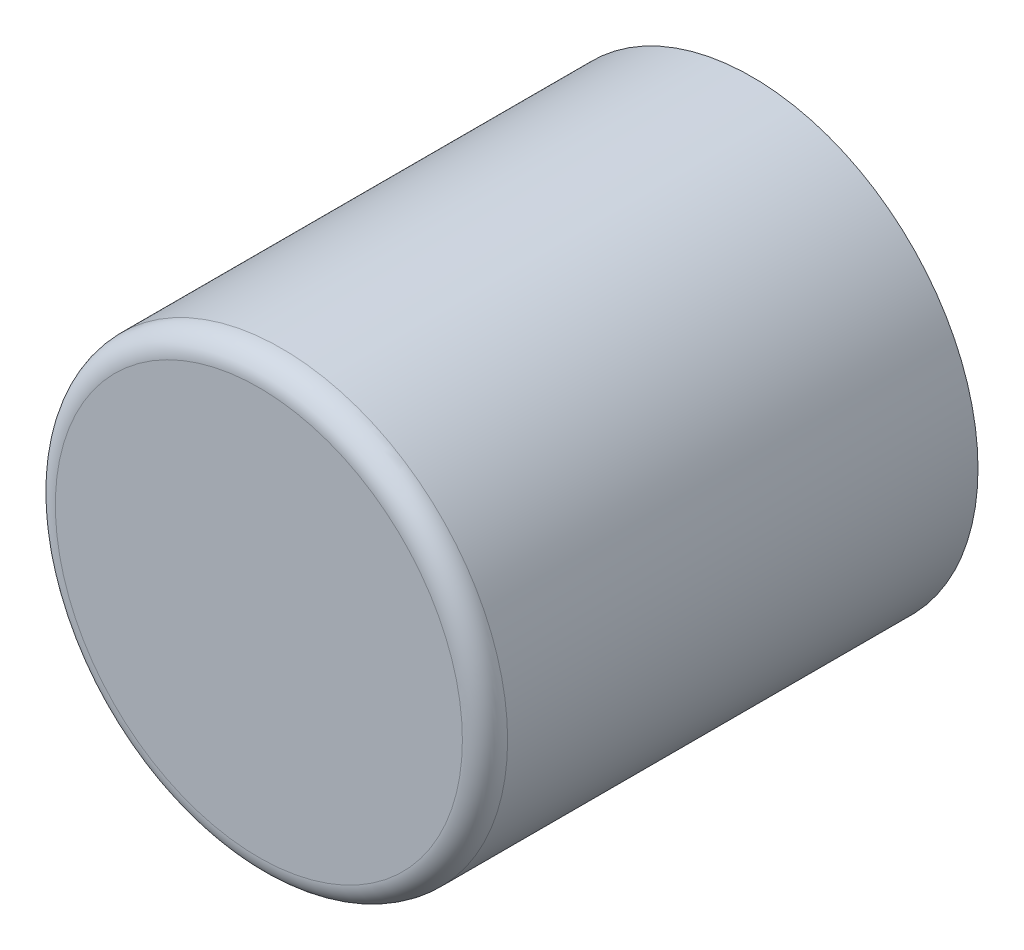
from build123d import *

# Parameters (mm, degrees)
BOSS_EXTRUDE1_DEPTH      = 150
BOSS_EXTRUDE1_DEPTH_BACK = 68
SKETCH2_R                = 100
CUT_EXTRUDE1_DEPTH       = 20
CUT_EXTRUDE1_DEPTH_BACK  = 200
SKETCH6_R                = 90
FILLET1_R                = 10


with BuildPart() as part:
    # Sketch2 → Boss-Extrude1 (new, two sides: drawn at the far end of the back side and taken through both)
    with BuildSketch(Plane.XY.offset(-BOSS_EXTRUDE1_DEPTH_BACK)):
        Circle(SKETCH2_R)
    extrude(amount=BOSS_EXTRUDE1_DEPTH + BOSS_EXTRUDE1_DEPTH_BACK)

    # Sketch6 → Cut-Extrude1 (cut, two sides: drawn at the far end of the back side and taken through both)
    with BuildSketch(Plane(origin=(0, 0, -68), x_dir=(-1, 0, 0), z_dir=(0, 0, -1)).offset(-CUT_EXTRUDE1_DEPTH_BACK)):
        with Locations(Location((0, 0, 0), (0, 0, 180))):
            Circle(SKETCH6_R)
    extrude(amount=CUT_EXTRUDE1_DEPTH + CUT_EXTRUDE1_DEPTH_BACK, mode=Mode.SUBTRACT)

    # Fillet1
    fillet1_edges = [part.edges().sort_by_distance(p)[0] for p in [
        (-100, 0, 150),
    ]]
    fillet(fillet1_edges, radius=FILLET1_R)


solid = part.part
